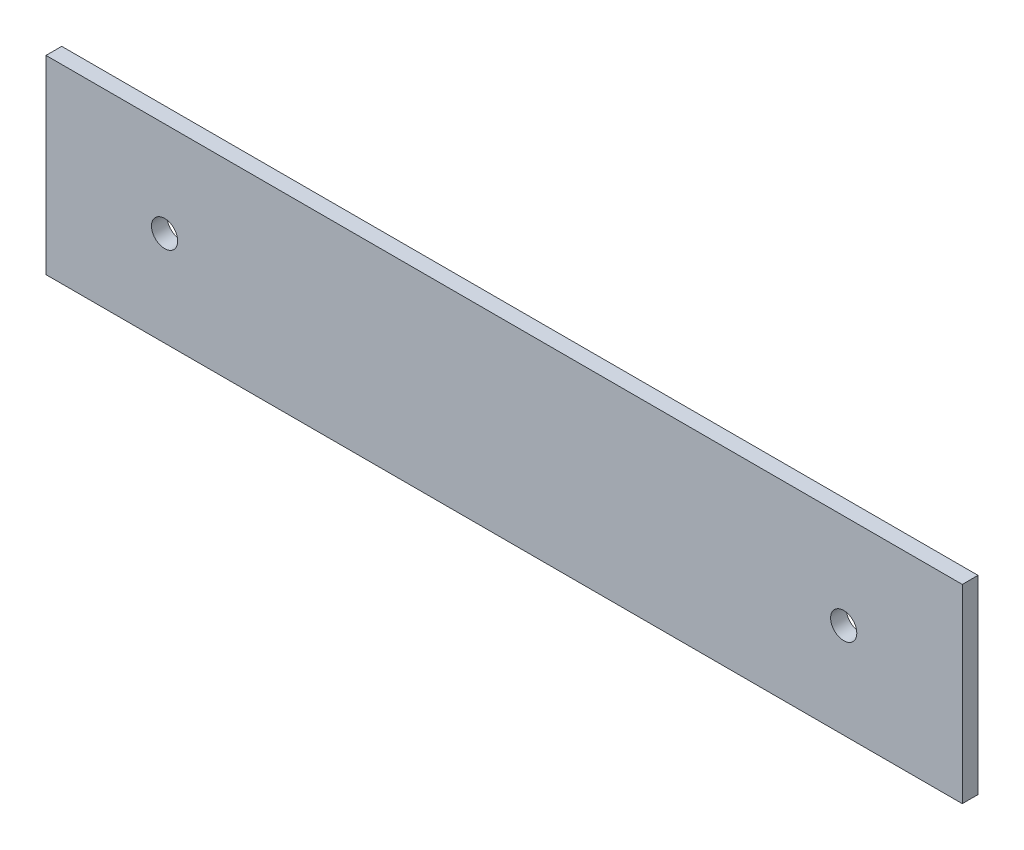
from build123d import *

# Parameters (mm, degrees)
ESQUISSE2_W             = 175
ESQUISSE2_H             = 3
BOSS_EXTRU_1_DEPTH      = 36.27
ESQUISSE3_R             = 2.5
ENL_V_MAT_EXTRU_1_DEPTH = 106.213182302


with BuildPart() as part:
    # Esquisse2 → Boss.-Extru.1 (new body)
    with BuildSketch(Plane(origin=(0, 0, 0), x_dir=(1, 0, 0), z_dir=(0, 1, 0))):
        with Locations((11.218290251, -2.666038947)):
            Rectangle(ESQUISSE2_W, ESQUISSE2_H)
    extrude(amount=BOSS_EXTRU_1_DEPTH)

    # Esquisse3 → Enlèv. mat.-Extru.1 (cut, through all)
    with BuildSketch(Plane.XY.offset(4.166038947)):
        with Locations((-53.631709749, 18.135)):
            Circle(ESQUISSE3_R)
        with Locations((76.068290251, 18.135)):
            Circle(ESQUISSE3_R)
    extrude(amount=-ENL_V_MAT_EXTRU_1_DEPTH, mode=Mode.SUBTRACT)


solid = part.part
